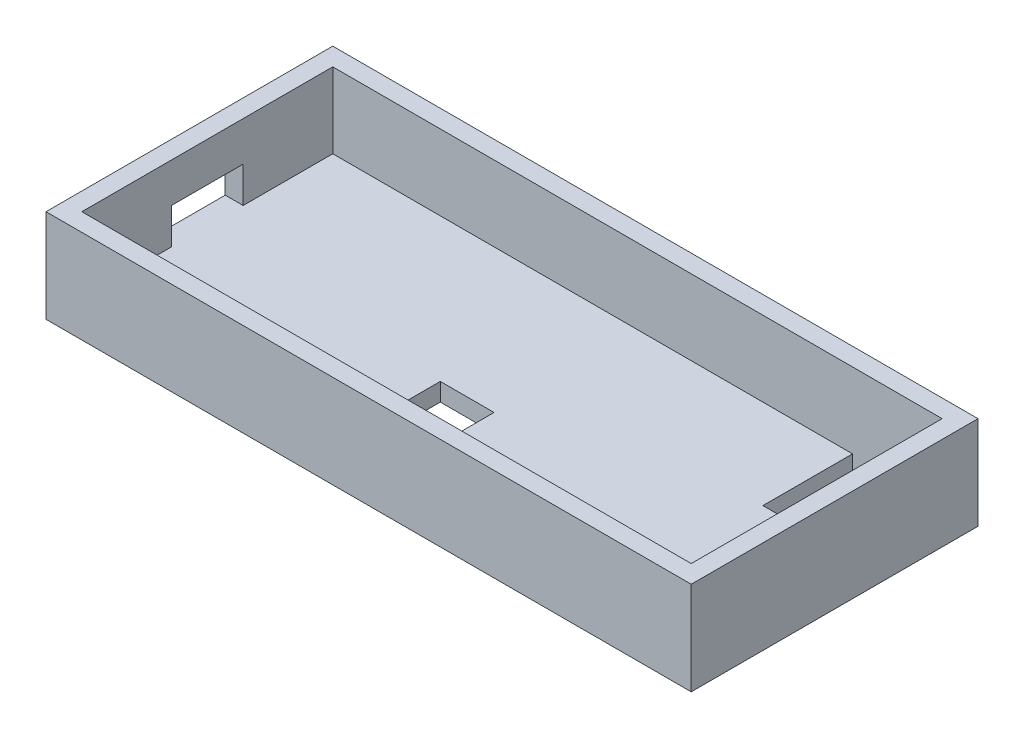
from build123d import *

# Parameters (mm, degrees)
SKETCH2_W           = 180
SKETCH2_H           = 80
BOSS_EXTRUDE1_DEPTH = 26
SKETCH2_4_W         = 15
SKETCH2_4_H         = 10
SKETCH2_4_R         = 5
BOSS_EXTRUDE2_DEPTH = 5
SKETCH3_W           = 20
SKETCH3_H           = 10
CUT_EXTRUDE1_DEPTH  = 5


with BuildPart() as part:
    # Sketch2 → Boss-Extrude1 (new body)
    with BuildSketch(Plane(origin=(0, 0, 0), x_dir=(1, 0, 0), z_dir=(0, 1, 0))):
        Rectangle(SKETCH2_W, SKETCH2_H)
        Polygon((60, -35), (-15, -35), (-85, -35), (-85, -15), (-85, 35), (60, 35), (85, 35), (85, 10), (85, -10), (85, -35), align=None, mode=Mode.SUBTRACT)
    extrude(amount=BOSS_EXTRUDE1_DEPTH)

    # Sketch2<4> → Boss-Extrude2 (add)
    with BuildSketch(Plane(origin=(0, 0, 0), x_dir=(1, 0, 0), z_dir=(0, 1, 0))):
        Polygon((-85, -35), (85, -35), (85, 10), (60, 10), (60, 35), (-85, 35), align=None)
        with Locations((-7.5, -10)):
            Rectangle(SKETCH2_4_W, SKETCH2_4_H, mode=Mode.SUBTRACT)
        with Locations((75.926069333, -27.828662368)):
            Circle(SKETCH2_4_R, mode=Mode.SUBTRACT)
    extrude(amount=BOSS_EXTRUDE2_DEPTH)

    # Sketch3 → Cut-Extrude1 (cut)
    with BuildSketch(Plane.ZY.offset(90)):
        with Locations((0, 10)):
            Rectangle(SKETCH3_W, SKETCH3_H)
    extrude(amount=-CUT_EXTRUDE1_DEPTH, mode=Mode.SUBTRACT)


solid = part.part
